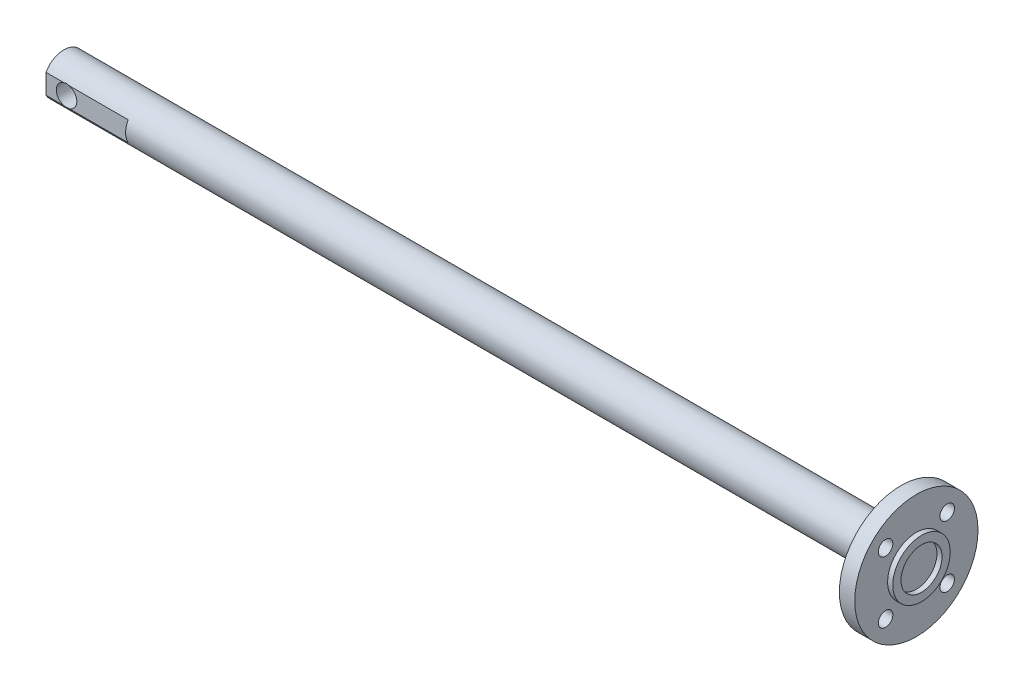
from build123d import *

# Parameters (mm, degrees)
SKETCH1_R                       = 19.05
BOSS_EXTRUDE1_DEPTH             = 263.525
SKETCH2_W                       = 258.7625
SKETCH2_H                       = 12.7
CUT_EXTRUDE1_DEPTH              = 265.898528922
CUT_EXTRUDE1_DEPTH_BACK         = 265.898528922
SKETCH8_W                       = 25.4
SKETCH8_H                       = 0.79375
F_1_1_DIAMETER_HOLE2_D          = 6.35
F_16_0_177_DIAMETER_HOLE1_D     = 4.4958
F_16_0_177_DIAMETER_HOLE1_DEPTH = 25.4
F_16_0_177_DIAMETER_HOLE1_TIP   = 1.350674586
BOSS_EXTRUDE2_START             = 1.5875
SKETCH15_R                      = 8.89
SKETCH15_R_2                    = 6.35
BOSS_EXTRUDE2_DEPTH             = 1.5875


with BuildPart() as part:
    # Sketch1 → Boss-Extrude1 (new body)
    with BuildSketch(Plane(origin=(0, 0, 0), x_dir=(0, 0, -1), z_dir=(1, 0, 0))):
        Circle(SKETCH1_R)
    extrude(amount=BOSS_EXTRUDE1_DEPTH)

    # Sketch2 → Cut-Revolve1 (revolve, cut)
    with BuildSketch(Plane.XY, mode=Mode.PRIVATE) as cut_revolve1_sk:
        with Locations((129.38125, 12.7)):
            Rectangle(SKETCH2_W, SKETCH2_H)
    revolve(cut_revolve1_sk.sketch.rotate(Axis((-16.52066387, 0, 0), (1, 0, 0)), 90), axis=Axis((-16.52066387, 0, 0), (1, 0, 0)), mode=Mode.SUBTRACT)

    # Sketch8 → Cut-Extrude1 (cut, two sides: drawn at the far end of the back side and taken through both)
    with BuildSketch(Plane(origin=(0, 0, 0), x_dir=(1, 0, 0), z_dir=(0, 1, 0)).offset(-CUT_EXTRUDE1_DEPTH_BACK)):
        with Locations((12.7, 5.953125)):
            Rectangle(SKETCH8_W, SKETCH8_H)
        with Locations((12.7, -5.953125)):
            Rectangle(SKETCH8_W, SKETCH8_H)
    extrude(amount=CUT_EXTRUDE1_DEPTH + CUT_EXTRUDE1_DEPTH_BACK, mode=Mode.SUBTRACT)

    # 1 (1) Diameter Hole2 (through all)
    with Locations(Plane(origin=(0, 0, -5.55625), x_dir=(-1, 0, 0), z_dir=(0, 0, -1))):
        with Locations((-6.35, 0)):
            Hole(F_1_1_DIAMETER_HOLE2_D / 2)

    # #16 (0.177) Diameter Hole1
    with Locations(Plane.ZY.offset(-258.7625)):
        with Locations((9.525, 9.525), (-9.525, -9.525), (-9.525, 9.525), (9.525, -9.525)):
            Hole(F_16_0_177_DIAMETER_HOLE1_D / 2, depth=F_16_0_177_DIAMETER_HOLE1_DEPTH)
            with Locations((0, 0, -(F_16_0_177_DIAMETER_HOLE1_DEPTH + F_16_0_177_DIAMETER_HOLE1_TIP / 2))):  # 118° drill point
                Cone(0, F_16_0_177_DIAMETER_HOLE1_D / 2, F_16_0_177_DIAMETER_HOLE1_TIP, mode=Mode.SUBTRACT)

    # Sketch15 → Boss-Extrude2 (add)
    with BuildSketch(Plane(origin=(263.525, 0, 0), x_dir=(0, 0, -1), z_dir=(1, 0, 0)).offset(BOSS_EXTRUDE2_START)):
        Circle(SKETCH15_R)
        with Locations(Location((0, 0, 0), (0, 0, 180))):
            Circle(SKETCH15_R_2, mode=Mode.SUBTRACT)
    extrude(amount=-BOSS_EXTRUDE2_DEPTH)


solid = part.part
